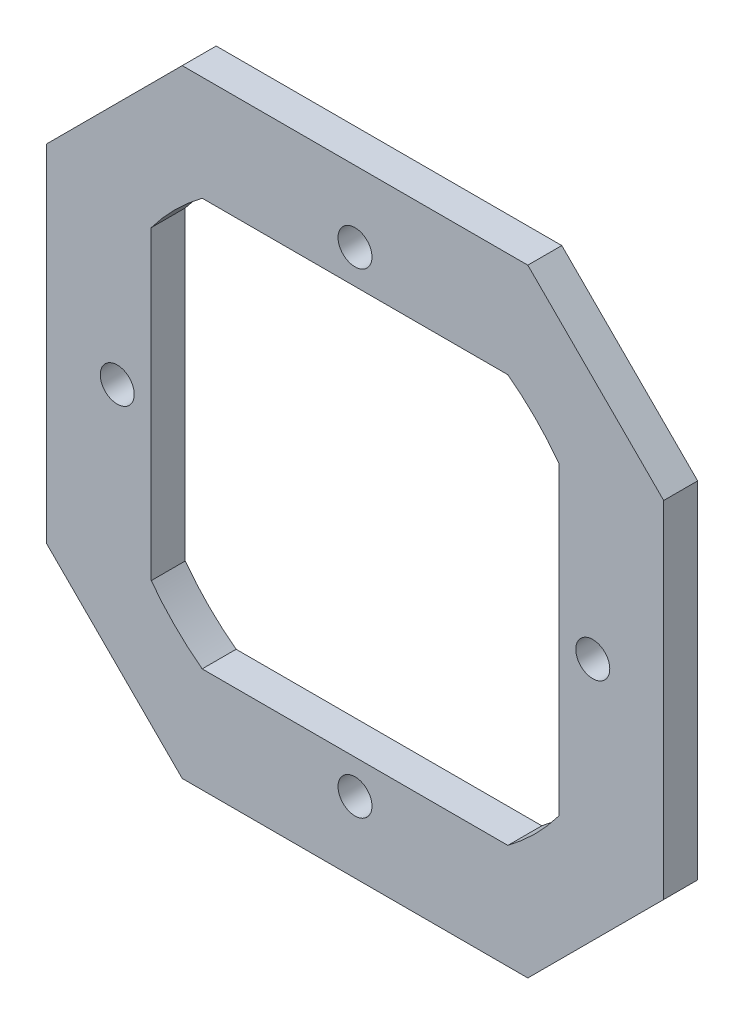
from build123d import *

# Parameters (mm, degrees)
SKETCH_1_R      = 1
EXTRUDE_1_DEPTH = 2


with BuildPart() as part:
    # 草图1 → 凸台-拉伸1 (new body)
    with BuildSketch(Plane.XY):
        Polygon((-18.175, 10.175), (-10.175, 18.175), (10.175, 18.175), (18.175, 10.175), (18.175, -10.175), (10.175, -18.175), (-10.175, -18.175), (-18.175, -10.175), align=None)
        with Locations((0, 14)):
            Circle(SKETCH_1_R, mode=Mode.SUBTRACT)
        with Locations((14, 0)):
            Circle(SKETCH_1_R, mode=Mode.SUBTRACT)
        with Locations((-14, 0)):
            Circle(SKETCH_1_R, mode=Mode.SUBTRACT)
        with Locations((0, -14)):
            Circle(SKETCH_1_R, mode=Mode.SUBTRACT)
        with BuildLine():
            Line((-9, 12), (9, 12))
            ThreePointArc((9, 12), (10.606601718, 10.606601718), (12, 9))
            Line((12, 9), (12, -9))
            ThreePointArc((12, -9), (10.606601718, -10.606601718), (9, -12))
            Line((9, -12), (-9, -12))
            ThreePointArc((-9, -12), (-10.606601718, -10.606601718), (-12, -9))
            Line((-12, -9), (-12, 9))
            ThreePointArc((-12, 9), (-10.606601718, 10.606601718), (-9, 12))
        make_face(mode=Mode.SUBTRACT)
    extrude(amount=EXTRUDE_1_DEPTH)


solid = part.part
